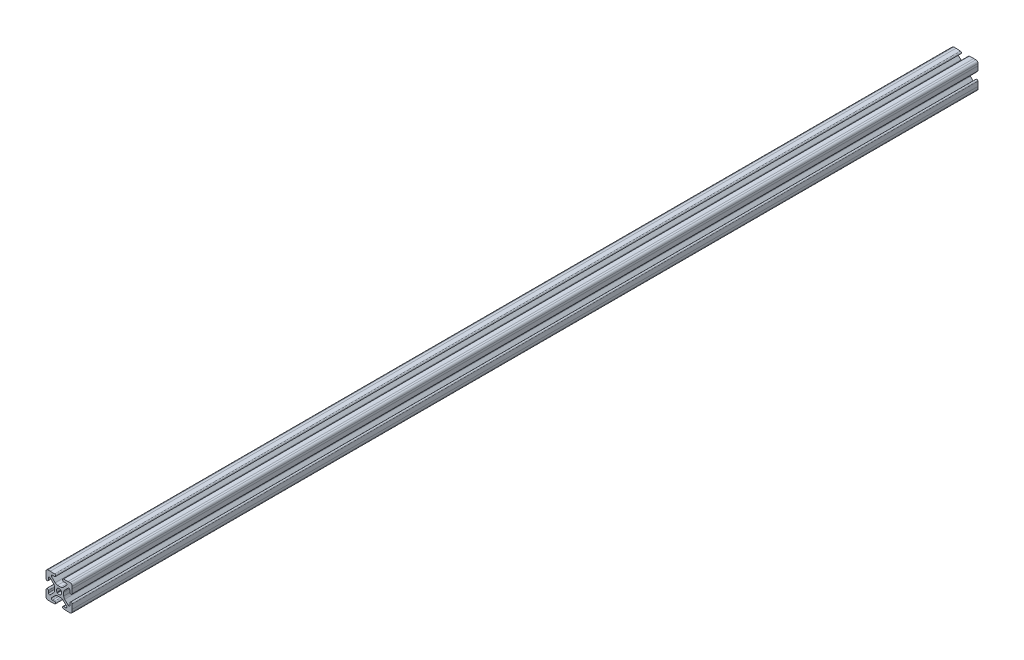
from build123d import *

# Parameters (mm, degrees)
BOSS_EXTRUDE1_DEPTH = 863.6


with BuildPart() as part:
    # Model → Boss-Extrude1 (new body)
    with BuildSketch(Plane.XY):
        with BuildLine():
            Line((50.659960212, 72.999871414), (53.774553856, 72.999871414))
            ThreePointArc((53.774553856, 72.999871414), (54.989573754, 72.758188929), (56.019617887, 72.069935444))
            Line((56.019617887, 72.069935444), (59.264200891, 68.825352439))
            ThreePointArc((59.264200891, 68.825352439), (59.477513437, 67.701802895), (58.510322513, 67.091550869))
            Line((58.510322513, 67.091550869), (56.572487817, 67.159221548))
            ThreePointArc((56.572487817, 67.159221548), (55.4691069, 66.130302197), (56.498026251, 65.026921279))
            Line((56.498026251, 65.026921279), (60.677257034, 64.880979325))
            Line((60.677257034, 64.880979325), (62.710657034, 64.880979325))
            ThreePointArc((62.710657034, 64.880979325), (64.129537501, 65.468698857), (64.717257034, 66.887579325))
            Line((64.717257034, 66.887579325), (64.717257034, 68.920979325))
            Line((64.717257034, 68.920979325), (64.57131508, 73.100210108))
            ThreePointArc((64.57131508, 73.100210108), (63.467934162, 74.129129459), (62.439014811, 73.025748542))
            Line((62.439014811, 73.025748542), (62.50668549, 71.087913846))
            ThreePointArc((62.50668549, 71.087913846), (61.896433464, 70.120722922), (60.77288392, 70.334035468))
            Line((60.77288392, 70.334035468), (57.528300915, 73.578618472))
            ThreePointArc((57.528300915, 73.578618472), (56.84004743, 74.608662605), (56.598364945, 75.823682503))
            Line((56.598364945, 75.823682503), (56.598364945, 78.938276147))
            ThreePointArc((56.598364945, 78.938276147), (56.84004743, 80.153296044), (57.528300915, 81.183340177))
            Line((57.528300915, 81.183340177), (60.77288392, 84.427923182))
            ThreePointArc((60.77288392, 84.427923182), (61.896433464, 84.641235728), (62.50668549, 83.674044803))
            Line((62.50668549, 83.674044803), (62.439014811, 81.736210108))
            ThreePointArc((62.439014811, 81.736210108), (63.467934162, 80.63282919), (64.57131508, 81.661748542))
            Line((64.57131508, 81.661748542), (64.717257034, 85.840979325))
            Line((64.717257034, 85.840979325), (64.717257034, 87.874379325))
            ThreePointArc((64.717257034, 87.874379325), (64.129537501, 89.293259792), (62.710657034, 89.880979325))
            Line((62.710657034, 89.880979325), (60.677257034, 89.880979325))
            Line((60.677257034, 89.880979325), (56.498026251, 89.73503737))
            ThreePointArc((56.498026251, 89.73503737), (55.4691069, 88.631656452), (56.572487817, 87.602737101))
            Line((56.572487817, 87.602737101), (58.510322513, 87.67040778))
            ThreePointArc((58.510322513, 87.67040778), (59.477513437, 87.060155754), (59.264200891, 85.93660621))
            Line((59.264200891, 85.93660621), (56.019617887, 82.692023205))
            ThreePointArc((56.019617887, 82.692023205), (54.989573754, 82.00376972), (53.774553856, 81.762087236))
            Line((53.774553856, 81.762087236), (50.659960212, 81.762087236))
            ThreePointArc((50.659960212, 81.762087236), (49.444940315, 82.00376972), (48.414896182, 82.692023205))
            Line((48.414896182, 82.692023205), (45.170313177, 85.93660621))
            ThreePointArc((45.170313177, 85.93660621), (44.957000631, 87.060155754), (45.924191556, 87.67040778))
            Line((45.924191556, 87.67040778), (47.862026251, 87.602737101))
            ThreePointArc((47.862026251, 87.602737101), (48.965407169, 88.631656452), (47.936487817, 89.73503737))
            Line((47.936487817, 89.73503737), (43.757257034, 89.880979325))
            Line((43.757257034, 89.880979325), (41.723857034, 89.880979325))
            ThreePointArc((41.723857034, 89.880979325), (40.304976567, 89.293259792), (39.717257034, 87.874379325))
            Line((39.717257034, 87.874379325), (39.717257034, 85.840979325))
            Line((39.717257034, 85.840979325), (39.863198989, 81.661748542))
            ThreePointArc((39.863198989, 81.661748542), (40.966579907, 80.63282919), (41.995499258, 81.736210108))
            Line((41.995499258, 81.736210108), (41.927828579, 83.674044803))
            ThreePointArc((41.927828579, 83.674044803), (42.538080605, 84.641235728), (43.661630149, 84.427923182))
            Line((43.661630149, 84.427923182), (46.906213154, 81.183340177))
            ThreePointArc((46.906213154, 81.183340177), (47.594466639, 80.153296044), (47.836149123, 78.938276147))
            Line((47.836149123, 78.938276147), (47.836149123, 75.823682503))
            ThreePointArc((47.836149123, 75.823682503), (47.594466639, 74.608662605), (46.906213154, 73.578618472))
            Line((46.906213154, 73.578618472), (43.661630149, 70.334035468))
            ThreePointArc((43.661630149, 70.334035468), (42.538080605, 70.120722922), (41.927828579, 71.087913846))
            Line((41.927828579, 71.087913846), (41.995499258, 73.025748542))
            ThreePointArc((41.995499258, 73.025748542), (40.966579907, 74.129129459), (39.863198989, 73.100210108))
            Line((39.863198989, 73.100210108), (39.717257034, 68.920979325))
            Line((39.717257034, 68.920979325), (39.717257034, 66.887579325))
            ThreePointArc((39.717257034, 66.887579325), (40.304976567, 65.468698857), (41.723857034, 64.880979325))
            Line((41.723857034, 64.880979325), (43.757257034, 64.880979325))
            Line((43.757257034, 64.880979325), (47.936487817, 65.026921279))
            ThreePointArc((47.936487817, 65.026921279), (48.965407169, 66.130302197), (47.862026251, 67.159221548))
            Line((47.862026251, 67.159221548), (45.924191556, 67.091550869))
            ThreePointArc((45.924191556, 67.091550869), (44.957000631, 67.701802895), (45.170313177, 68.825352439))
            Line((45.170313177, 68.825352439), (48.414896182, 72.069935444))
            ThreePointArc((48.414896182, 72.069935444), (49.444940315, 72.758188929), (50.659960212, 72.999871414))
        make_face()
        with BuildLine():
            Line((50.64953831, 75.433607249), (50.269884959, 75.433607249))
            Line((50.269884959, 75.433607249), (50.269884959, 75.8132606))
            ThreePointArc((50.269884959, 75.8132606), (53.985023987, 79.148746278), (50.64953831, 75.433607249))
        make_face(mode=Mode.SUBTRACT)
    extrude(amount=BOSS_EXTRUDE1_DEPTH)


solid = part.part
